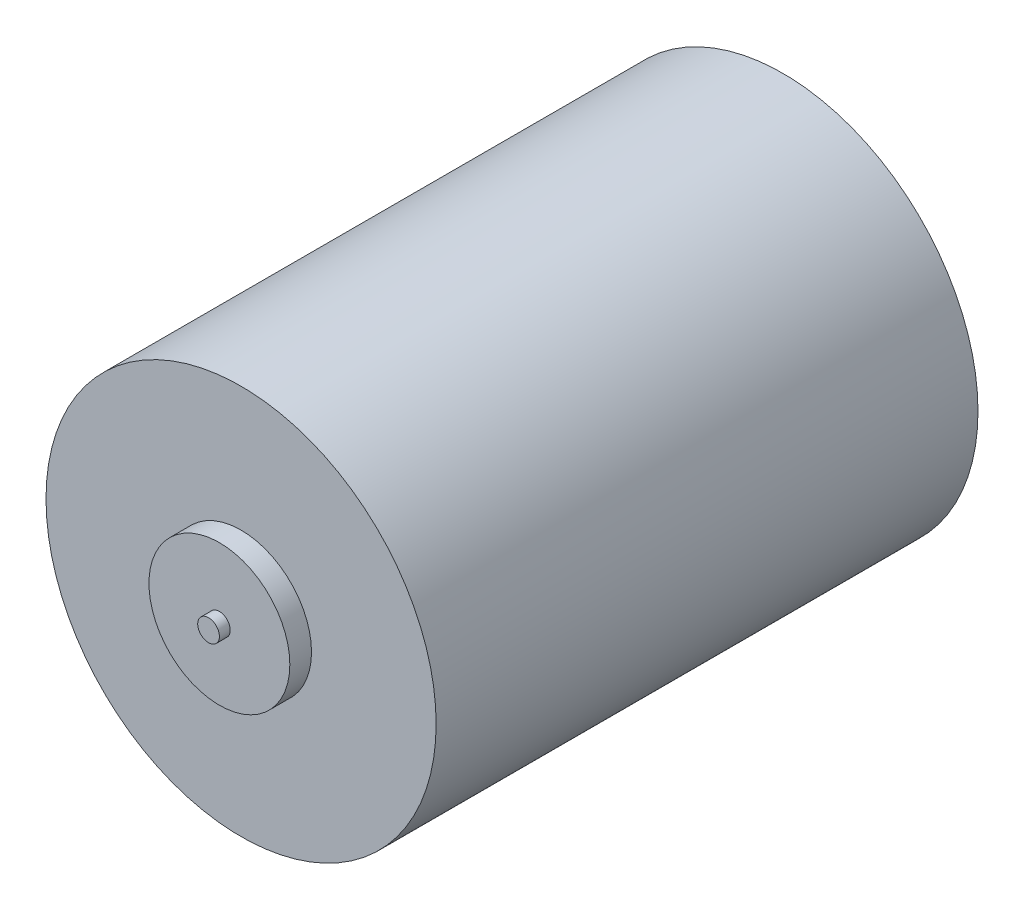
from build123d import *

# Parameters (mm, degrees)
SKETCH1_R           = 18
BOSS_EXTRUDE1_DEPTH = 50
SKETCH2_R           = 6.5
BOSS_EXTRUDE2_DEPTH = 2
SKETCH3_R           = 1
BOSS_EXTRUDE3_DEPTH = 1


with BuildPart() as part:
    # Sketch1 → Boss-Extrude1 (new body)
    with BuildSketch(Plane.XY):
        Circle(SKETCH1_R)
    extrude(amount=BOSS_EXTRUDE1_DEPTH)

    # Sketch2 → Boss-Extrude2 (add)
    with BuildSketch(Plane.XY.offset(50)):
        Circle(SKETCH2_R)
    extrude(amount=BOSS_EXTRUDE2_DEPTH)

    # Sketch3 → Boss-Extrude3 (add)
    with BuildSketch(Plane.XY.offset(52)):
        Circle(SKETCH3_R)
    extrude(amount=BOSS_EXTRUDE3_DEPTH)


solid = part.part
